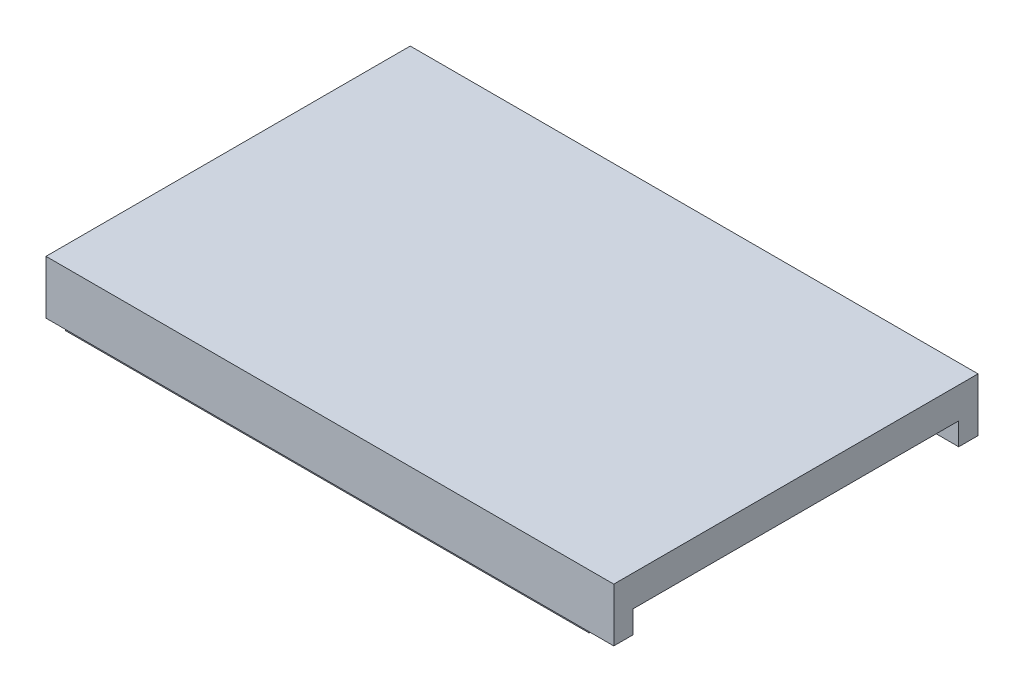
from build123d import *

# Parameters (mm, degrees)
SKETCH1_W             = 53
SKETCH1_H             = 34
BOSS_EXTRUDE1_DEPTH   = 5
SKETCH2_W             = 48.6
SKETCH2_H             = 31.6
CUT_EXTRUDE1_DEPTH    = 3.5
BOSS_EXTRUDE2_DEPTH   = 1
SKETCH4_W             = 1.2
SKETCH4_H             = 10
CUT_EXTRUDE2_DEPTH    = 0.5
SKETCH5_W             = 3.2
SKETCH5_H             = 30.4
CUT_EXTRUDE3_DEPTH    = 2.1
SKETCH6_W             = 5.4
SKETCH6_H             = 5.4
SKETCH6_H_2           = 4.3
BOSS_EXTRUDE3_DEPTH   = 3
SKETCH7_R             = 1.6
BOSS_EXTRUDE4_DEPTH   = 1.2
M2_TAPPED_HOLE1_D     = 1.6
M2_TAPPED_HOLE1_DEPTH = 5.2
M2_TAPPED_HOLE1_TIP   = 0.480688495


with BuildPart() as part:
    # Sketch1 → Boss-Extrude1 (new body)
    with BuildSketch(Plane(origin=(0, 0, 0), x_dir=(1, 0, 0), z_dir=(0, 1, 0))):
        with Locations((26.5, 17)):
            Rectangle(SKETCH1_W, SKETCH1_H)
    extrude(amount=BOSS_EXTRUDE1_DEPTH)

    # Sketch2 → Cut-Extrude1 (cut)
    with BuildSketch(Plane.XZ):
        with Locations((25.5, -17)):
            Rectangle(SKETCH2_W, SKETCH2_H)
    extrude(amount=-CUT_EXTRUDE1_DEPTH, mode=Mode.SUBTRACT)

    # Sketch3 → Boss-Extrude2 (add)
    with BuildSketch(Plane.XZ):
        Polygon((49.8, -1.2), (1.2, -1.2), (1.2, -12), (0.9, -12), (0.9, -0.9), (49.8, -0.9), align=None)
        Polygon((1.2, -22), (1.2, -32.8), (49.8, -32.8), (49.8, -33.1), (0.9, -33.1), (0.9, -22), align=None)
    extrude(amount=BOSS_EXTRUDE2_DEPTH)

    # Sketch4 → Cut-Extrude2 (cut)
    with BuildSketch(Plane.XZ):
        with Locations((0.6, -17)):
            Rectangle(SKETCH4_W, SKETCH4_H)
    extrude(amount=-CUT_EXTRUDE2_DEPTH, mode=Mode.SUBTRACT)

    # Sketch5 → Cut-Extrude3 (cut)
    with BuildSketch(Plane.XZ):
        with Locations((51.4, -17)):
            Rectangle(SKETCH5_W, SKETCH5_H)
    extrude(amount=-CUT_EXTRUDE3_DEPTH, mode=Mode.SUBTRACT)

    # Sketch6 → Boss-Extrude3 (add)
    with BuildSketch(Plane.XZ.offset(-3.5)):
        with Locations((3.9, -3.9)):
            Rectangle(SKETCH6_W, SKETCH6_H)
        with Locations((3.9, -30.65)):
            Rectangle(SKETCH6_W, SKETCH6_H_2)
    extrude(amount=BOSS_EXTRUDE3_DEPTH)

    # Sketch7 → Boss-Extrude4 (add)
    with BuildSketch(Plane.XZ.offset(-0.5)):
        with Locations(Location((5, -5, 0), (0, 0, 270))):
            Circle(SKETCH7_R)
        with Locations((5, -30.5)):
            Circle(SKETCH7_R)
    extrude(amount=BOSS_EXTRUDE4_DEPTH)

    # M2 Tapped Hole1
    with Locations(Plane(origin=(5, -0.7, -5), x_dir=(0, 0, -1), z_dir=(0, -1, 0))):
        with Locations((0, 0), (25.5, 0)):
            Hole(M2_TAPPED_HOLE1_D / 2, depth=M2_TAPPED_HOLE1_DEPTH)
            with Locations((0, 0, -(M2_TAPPED_HOLE1_DEPTH + M2_TAPPED_HOLE1_TIP / 2))):  # 118° drill point
                Cone(0, M2_TAPPED_HOLE1_D / 2, M2_TAPPED_HOLE1_TIP, mode=Mode.SUBTRACT)


solid = part.part
